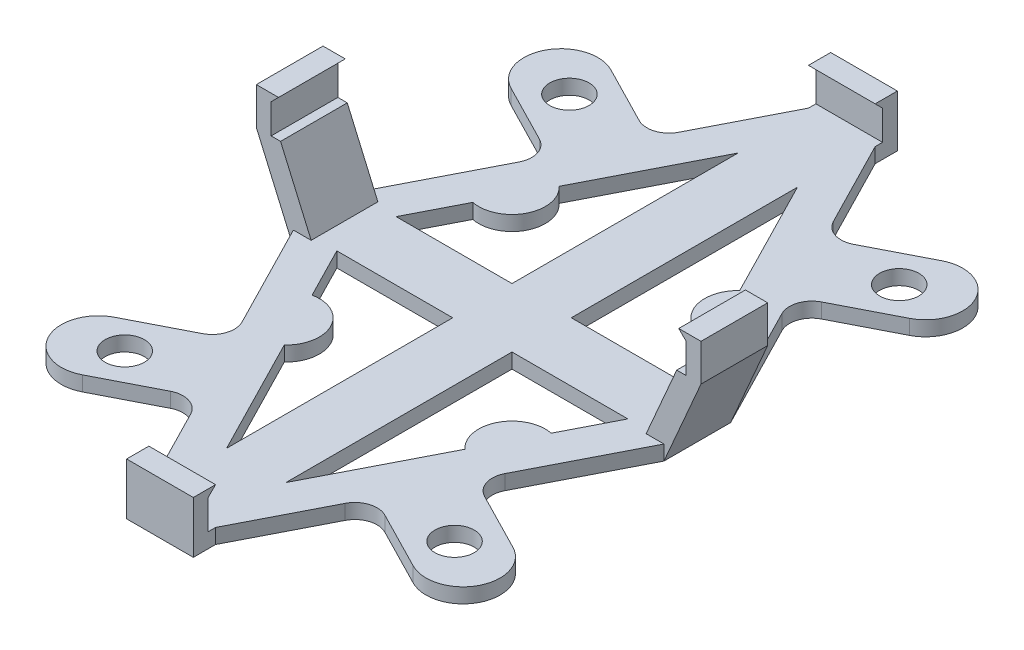
from build123d import *

# Parameters (mm, degrees)
SKETCH1_R           = 2.65
BOSS_EXTRUDE1_DEPTH = 1
BOSS_EXTRUDE4_DEPTH = 4.5
BOSS_EXTRUDE5_DEPTH = 4.5


with BuildPart() as part:
    # Sketch1 → Boss-Extrude1 (new, symmetric)
    with BuildSketch(Plane(origin=(0, 0, 0), x_dir=(1, 0, 0), z_dir=(0, 1, 0))):
        with BuildLine():
            Line((4.5, 47.5), (-4.5, 47.5))
            Line((-4.5, 47.5), (-4.5, 44.5))
            Line((-4.5, 44.5), (-10.429017764, 32.931184851))
            ThreePointArc((-10.429017764, 32.931184851), (-12.17849868, 31.444109042), (-14.467089888, 31.629657472))
            Line((-14.467089888, 31.629657472), (-22.327869159, 35.658306849))
            ThreePointArc((-22.327869159, 35.658306849), (-29.057989367, 33.48909455), (-26.888777069, 26.758974343))
            Line((-26.888777069, 26.758974343), (-19.027997797, 22.730324967))
            ThreePointArc((-19.027997797, 22.730324967), (-17.540921988, 20.980844051), (-17.726470418, 18.692252842))
            Line((-17.726470418, 18.692252842), (-19.726418437, 14.789915246))
            Line((-19.726418437, 14.789915246), (-25, 4.5))
            Line((-25, 4.5), (-25, -4.5))
            Line((-25, -4.5), (-19.726418437, -14.789915246))
            Line((-19.726418437, -14.789915246), (-17.726470418, -18.692252842))
            ThreePointArc((-17.726470418, -18.692252842), (-17.540921988, -20.980844051), (-19.027997797, -22.730324967))
            Line((-19.027997797, -22.730324967), (-26.888777069, -26.758974343))
            ThreePointArc((-26.888777069, -26.758974343), (-29.057989367, -33.48909455), (-22.327869159, -35.658306849))
            Line((-22.327869159, -35.658306849), (-14.467089888, -31.629657472))
            ThreePointArc((-14.467089888, -31.629657472), (-12.17849868, -31.444109042), (-10.429017764, -32.931184851))
            Line((-10.429017764, -32.931184851), (-4.5, -44.5))
            Line((-4.5, -44.5), (-4.5, -47.5))
            Line((-4.5, -47.5), (4.5, -47.5))
            Line((4.5, -47.5), (4.5, -44.5))
            Line((4.5, -44.5), (10.429017764, -32.931184851))
            ThreePointArc((10.429017764, -32.931184851), (12.17849868, -31.444109042), (14.467089888, -31.629657472))
            Line((14.467089888, -31.629657472), (22.327869159, -35.658306849))
            ThreePointArc((22.327869159, -35.658306849), (29.057989367, -33.48909455), (26.888777069, -26.758974343))
            Line((26.888777069, -26.758974343), (19.027997797, -22.730324967))
            ThreePointArc((19.027997797, -22.730324967), (17.540921988, -20.980844051), (17.726470418, -18.692252842))
            Line((17.726470418, -18.692252842), (19.726418437, -14.789915246))
            Line((19.726418437, -14.789915246), (25, -4.5))
            Line((25, -4.5), (25, 4.5))
            Line((25, 4.5), (19.726418437, 14.789915246))
            Line((19.726418437, 14.789915246), (17.726470418, 18.692252842))
            ThreePointArc((17.726470418, 18.692252842), (17.540921988, 20.980844051), (19.027997797, 22.730324967))
            Line((19.027997797, 22.730324967), (26.888777069, 26.758974343))
            ThreePointArc((26.888777069, 26.758974343), (29.057989367, 33.48909455), (22.327869159, 35.658306849))
            Line((22.327869159, 35.658306849), (14.467089888, 31.629657472))
            ThreePointArc((14.467089888, 31.629657472), (12.17849868, 31.444109042), (10.429017764, 32.931184851))
            Line((10.429017764, 32.931184851), (4.5, 44.5))
            Line((4.5, 44.5), (4.5, 47.5))
        make_face()
        with Locations(Location((-22.25, 30, 0), (0, 0, 270))):
            Circle(SKETCH1_R, mode=Mode.SUBTRACT)
        with Locations(Location((-22.25, -30, 0), (0, 0, 270))):
            Circle(SKETCH1_R, mode=Mode.SUBTRACT)
        with Locations(Location((22.25, 30, 0), (0, 0, 270))):
            Circle(SKETCH1_R, mode=Mode.SUBTRACT)
        with Locations(Location((22.25, -30, 0), (0, 0, 270))):
            Circle(SKETCH1_R, mode=Mode.SUBTRACT)
        with BuildLine():
            Line((-4, 34.512880186), (-12.184076307, 18.543950806))
            ThreePointArc((-12.184076307, 18.543950806), (-11.245300372, 13.197591441), (-16.133581658, 10.837598902))
            Line((-16.133581658, 10.837598902), (-19.637851096, 4))
            Line((-19.637851096, 4), (-4, 4))
            Line((-4, 4), (-4, 34.512880186))
        make_face(mode=Mode.SUBTRACT)
        with BuildLine():
            Line((4, 4), (4, 34.512880186))
            Line((4, 34.512880186), (12.184076307, 18.543950806))
            ThreePointArc((12.184076307, 18.543950806), (11.245300372, 13.197591441), (16.133581658, 10.837598902))
            Line((16.133581658, 10.837598902), (19.637851096, 4))
            Line((19.637851096, 4), (4, 4))
        make_face(mode=Mode.SUBTRACT)
        with BuildLine():
            Line((4, -34.512880186), (12.184076307, -18.543950806))
            ThreePointArc((12.184076307, -18.543950806), (11.245300372, -13.197591441), (16.133581658, -10.837598902))
            Line((16.133581658, -10.837598902), (19.637851096, -4))
            Line((19.637851096, -4), (4, -4))
            Line((4, -4), (4, -34.512880186))
        make_face(mode=Mode.SUBTRACT)
        with BuildLine():
            Line((-4, -4), (-4, -34.512880186))
            Line((-4, -34.512880186), (-12.184076307, -18.543950806))
            ThreePointArc((-12.184076307, -18.543950806), (-11.245300372, -13.197591441), (-16.133581658, -10.837598902))
            Line((-16.133581658, -10.837598902), (-19.637851096, -4))
            Line((-19.637851096, -4), (-4, -4))
        make_face(mode=Mode.SUBTRACT)
    extrude(amount=BOSS_EXTRUDE1_DEPTH, both=True)

    # Sketch6 → Boss-Extrude4 (add, symmetric)
    with BuildSketch(Plane(origin=(0, 0, 0), x_dir=(0, 0, -1), z_dir=(1, 0, 0))):
        Polygon((47.5, 1), (47.5, 6), (44.5, 6), (45.5, 5), (45.5, 1), align=None)
        Polygon((-45.5, 1), (-47.5, 1), (-47.5, 6), (-44.5, 6), (-45.5, 5), align=None)
    extrude(amount=BOSS_EXTRUDE4_DEPTH, both=True)

    # Sketch4 → Boss-Extrude5 (add, symmetric)
    with BuildSketch(Plane.XY):
        Polygon((30, 10.5), (30, 15.5), (27, 15.5), (28, 14.5), (28, 10.5), (26.728712295, 10.5), (22.598277512, 1), (25, 1), (25, -1), align=None)
        Polygon((-28, 14.5), (-28, 10.5), (-26.728712295, 10.5), (-22.598277512, 1), (-25, 1), (-25, -1), (-30, 10.5), (-30, 15.5), (-27, 15.5), align=None)
    extrude(amount=BOSS_EXTRUDE5_DEPTH, both=True)


solid = part.part
